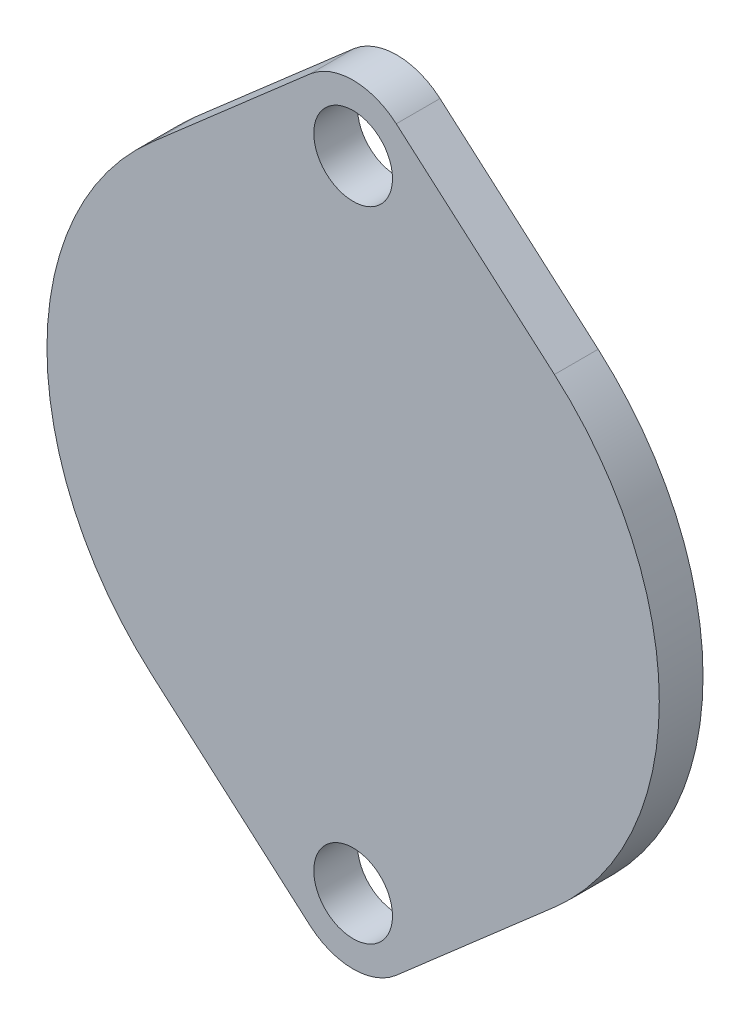
from build123d import *

# Parameters (mm, degrees)
SKETCH1_R           = 4.5
BOSS_EXTRUDE1_DEPTH = 5


with BuildPart() as part:
    # Sketch1 → Boss-Extrude1 (new body)
    with BuildSketch(Plane.XY):
        with BuildLine():
            Line((-4.931506849, -42.150684932), (-23.01369863, -26.369863014))
            ThreePointArc((-23.01369863, -26.369863014), (-35, 0), (-23.01369863, 26.369863014))
            Line((-23.01369863, 26.369863014), (-4.931506849, 42.150684932))
            ThreePointArc((-4.931506849, 42.150684932), (0, 44), (4.931506849, 42.150684932))
            Line((4.931506849, 42.150684932), (23.01369863, 26.369863014))
            ThreePointArc((23.01369863, 26.369863014), (35, 0), (23.01369863, -26.369863014))
            Line((23.01369863, -26.369863014), (4.931506849, -42.150684932))
            ThreePointArc((4.931506849, -42.150684932), (0, -44), (-4.931506849, -42.150684932))
        make_face()
        with Locations((0, 36.5)):
            Circle(SKETCH1_R, mode=Mode.SUBTRACT)
        with Locations((0, -36.5)):
            Circle(SKETCH1_R, mode=Mode.SUBTRACT)
    extrude(amount=BOSS_EXTRUDE1_DEPTH)


solid = part.part
